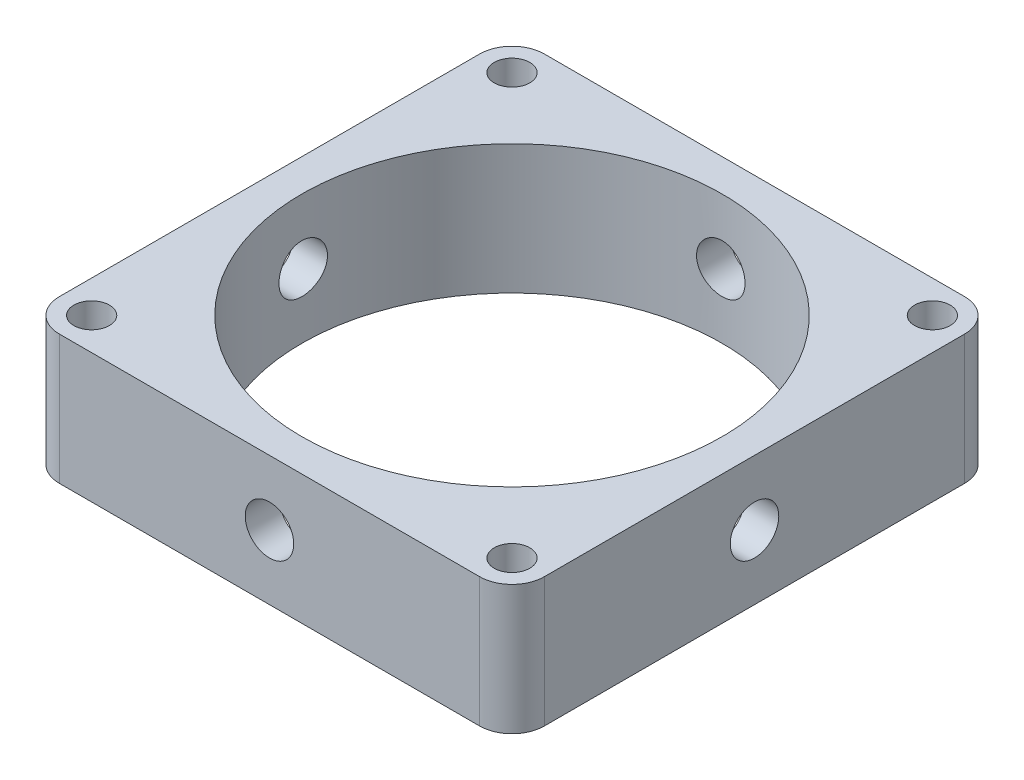
from build123d import *

# Parameters (mm, degrees)
SKETCH1_W           = 76.2
SKETCH1_H           = 76.2
SKETCH1_R           = 2.794
SKETCH1_R_2         = 33.02
BOSS_EXTRUDE1_DEPTH = 20.32
FILLET1_R           = 5.08
CUT_EXTRUDE1_DEPTH  = 88.58397342
CUT_EXTRUDE2_DEPTH  = 88.583973487


with BuildPart() as part:
    # Sketch1 → Boss-Extrude1 (new body)
    with BuildSketch(Plane(origin=(0, 0, 0), x_dir=(1, 0, 0), z_dir=(0, 1, 0))):
        Rectangle(SKETCH1_W, SKETCH1_H)
        with Locations(Location((33.02, 33.02, 0), (0, 0, 270))):
            Circle(SKETCH1_R, mode=Mode.SUBTRACT)
        with Locations(Location((33.02, -33.02, 0), (0, 0, 270))):
            Circle(SKETCH1_R, mode=Mode.SUBTRACT)
        with Locations(Location((-33.02, -33.02, 0), (0, 0, 270))):
            Circle(SKETCH1_R, mode=Mode.SUBTRACT)
        with Locations(Location((-33.02, 33.02, 0), (0, 0, 270))):
            Circle(SKETCH1_R, mode=Mode.SUBTRACT)
        with Locations(Location((0, 0, 0), (0, 0, 270))):
            Circle(SKETCH1_R_2, mode=Mode.SUBTRACT)
    extrude(amount=BOSS_EXTRUDE1_DEPTH)

    # Fillet1
    fillet1_edges = [part.edges().sort_by_distance(p)[0] for p in [
        (38.1, 10.16, 38.1),
        (-38.1, 10.16, 38.1),
        (-38.1, 10.16, -38.1),
        (38.1, 10.16, -38.1),
    ]]
    fillet(fillet1_edges, radius=FILLET1_R)

    # Sketch2 → Cut-Extrude1 (cut, through all)
    with BuildSketch(Plane.XY.offset(38.1)):
        with BuildLine():
            ThreePointArc((3.81, 10.16), (2.694076836, 12.854076836), (0, 13.97))
            Line((0, 13.97), (0, 6.35))
            ThreePointArc((0, 6.35), (2.694076836, 7.465923164), (3.81, 10.16))
        make_face()
        with BuildLine():
            Line((0, 6.35), (0, 13.97))
            ThreePointArc((0, 13.97), (-3.81, 10.16), (0, 6.35))
        make_face()
    extrude(amount=-CUT_EXTRUDE1_DEPTH, mode=Mode.SUBTRACT)

    # Sketch3 → Cut-Extrude2 (cut, through all)
    with BuildSketch(Plane(origin=(38.1, 0, 0), x_dir=(0, 0, -1), z_dir=(1, 0, 0))):
        with BuildLine():
            ThreePointArc((0, 13.97), (-3.81, 10.16), (0, 6.35))
            Line((0, 6.35), (0, 13.97))
        make_face()
        with BuildLine():
            Line((0, 13.97), (0, 6.35))
            ThreePointArc((0, 6.35), (2.694076836, 7.465923164), (3.81, 10.16))
            ThreePointArc((3.81, 10.16), (2.694076836, 12.854076836), (0, 13.97))
        make_face()
    extrude(amount=-CUT_EXTRUDE2_DEPTH, mode=Mode.SUBTRACT)


solid = part.part
